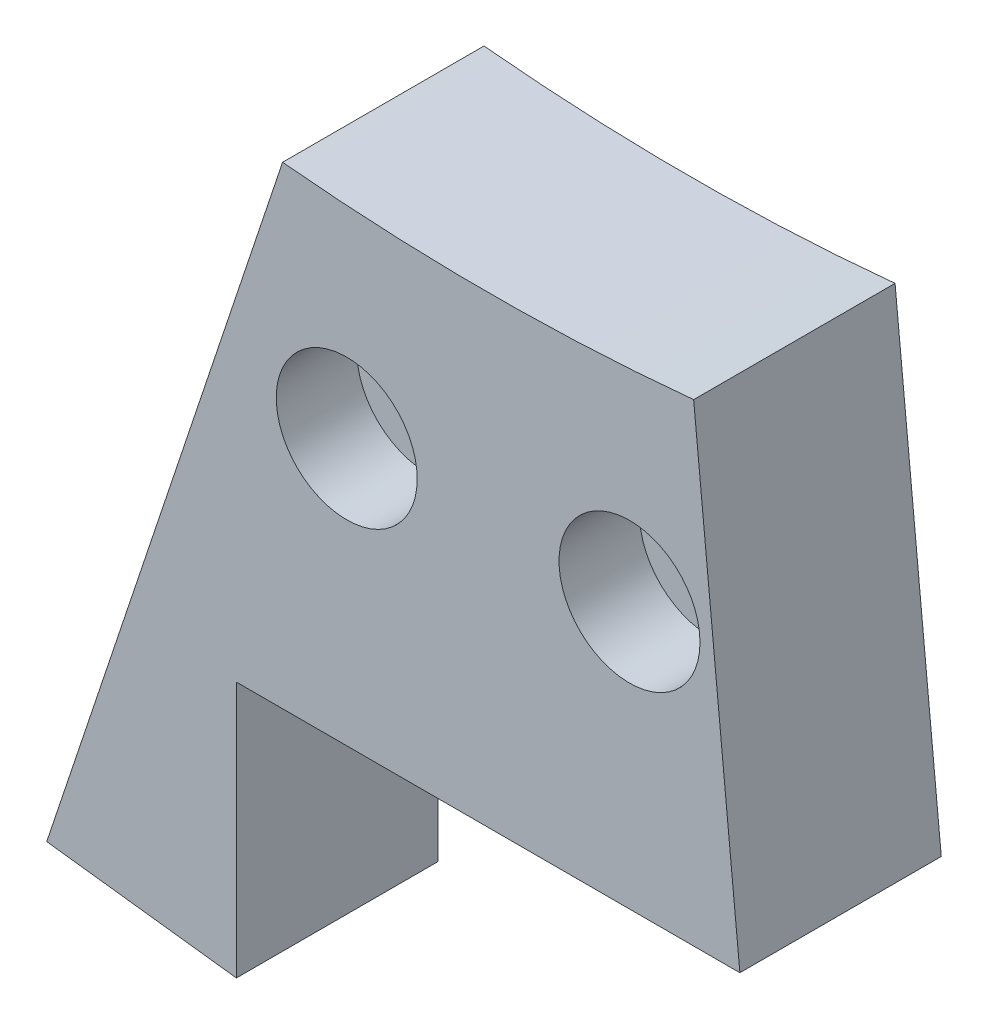
from build123d import *

# Parameters (mm, degrees)
BOSS_EXTRU_1_DEPTH      = 10
ESQUISSE2_R             = 1.025
ENL_V_MAT_EXTRU_1_DEPTH = 8
ENL_V_MAT_EXTRU_2_REACH = 130.997
ESQUISSE3_R             = 1.75
ESQUISSE4_R             = 3.5
ESQUISSE4_R_2           = 1.75
ENL_V_MAT_EXTRU_3_DEPTH = 4
BOSS_EXTRU_2_DEPTH      = 10
ESQUISSE6_R             = 2.75
ENL_V_MAT_EXTRU_4_DEPTH = 2


with BuildPart() as part:
    # Esquisse1 → Boss.-Extru.1 (new body)
    with BuildSketch(Plane.XY):
        with BuildLine():
            Line((-12.5, -128), (12.5, -128))
            Line((12.5, -128), (10.205358779, -104.502873894))
            ThreePointArc((10.205358779, -104.502873894), (0, -105), (-10.205358779, -104.502873894))
            Line((-10.205358779, -104.502873894), (-12.5, -128))
        make_face()
    extrude(amount=BOSS_EXTRU_1_DEPTH)

    # Esquisse2 → Enlèv. mat.-Extru.1 (cut)
    with BuildSketch(Plane.XZ.offset(128)):
        with Locations((-4.75, 6)):
            Circle(ESQUISSE2_R)
        with Locations((4.75, 6)):
            Circle(ESQUISSE2_R)
    extrude(amount=-ENL_V_MAT_EXTRU_1_DEPTH, mode=Mode.SUBTRACT)

    # Esquisse3 → Enlèv. mat.-Extru.2 (cut, up to next)
    with BuildSketch(Plane.XY.offset(10), mode=Mode.PRIVATE) as enl_v_mat_extru_2_sk1:
        with Locations((-7.020582047, -114.785501819)):
            Circle(ESQUISSE3_R)
    enl_v_mat_extru_2_tool1 = extrude(enl_v_mat_extru_2_sk1.sketch, amount=-ENL_V_MAT_EXTRU_2_REACH, mode=Mode.PRIVATE) & part.part
    # Esquisse3 → Enlèv. mat.-Extru.2 (cut, up to next)
    with BuildSketch(Plane.XY.offset(10), mode=Mode.PRIVATE) as enl_v_mat_extru_2_sk2:
        with Locations((7.020582047, -114.785501819)):
            Circle(ESQUISSE3_R)
    enl_v_mat_extru_2_tool2 = extrude(enl_v_mat_extru_2_sk2.sketch, amount=-ENL_V_MAT_EXTRU_2_REACH, mode=Mode.PRIVATE) & part.part
    add(enl_v_mat_extru_2_tool1.solids().sort_by_distance((-7.020582, -114.785502, 10))[0], mode=Mode.SUBTRACT)
    add(enl_v_mat_extru_2_tool2.solids().sort_by_distance((7.020582, -114.785502, 10))[0], mode=Mode.SUBTRACT)

    # Esquisse4 → Enlèv. mat.-Extru.3 (cut)
    # profile 1 of 2: a face of its own
    with BuildSketch(Plane.XY.offset(10)):
        with Locations((7.020582047, -114.785501819)):
            Circle(ESQUISSE4_R)
        with Locations((7.020582047, -114.785501819)):
            Circle(ESQUISSE4_R_2, mode=Mode.SUBTRACT)
    # profile 2 of 2: a face of its own
    with BuildSketch(Plane.XY.offset(10)):
        with Locations((-7.020582047, -114.785501819)):
            Circle(ESQUISSE4_R)
    extrude(amount=-ENL_V_MAT_EXTRU_3_DEPTH, mode=Mode.SUBTRACT)

    # Esquisse5 → Boss.-Extru.2 (add)
    with BuildSketch(Plane.XY.offset(10)):
        Polygon((-12.5, -140.725580344), (-21.915902578, -139.56945288), (-10.205358779, -104.502873894), (-12.5, -128), align=None)
    extrude(amount=-BOSS_EXTRU_2_DEPTH)

    # Esquisse6 → Enlèv. mat.-Extru.4 (cut)
    with BuildSketch(Plane(origin=(-17.207951289, -140.147516612, 0), x_dir=(0.9925461516413231, -0.12186934340513994, 0), z_dir=(-0.12186934340513994, -0.9925461516413231, 0))):
        with Locations((0, 5)):
            Circle(ESQUISSE6_R)
    extrude(amount=-ENL_V_MAT_EXTRU_4_DEPTH, mode=Mode.SUBTRACT)


solid = part.part
